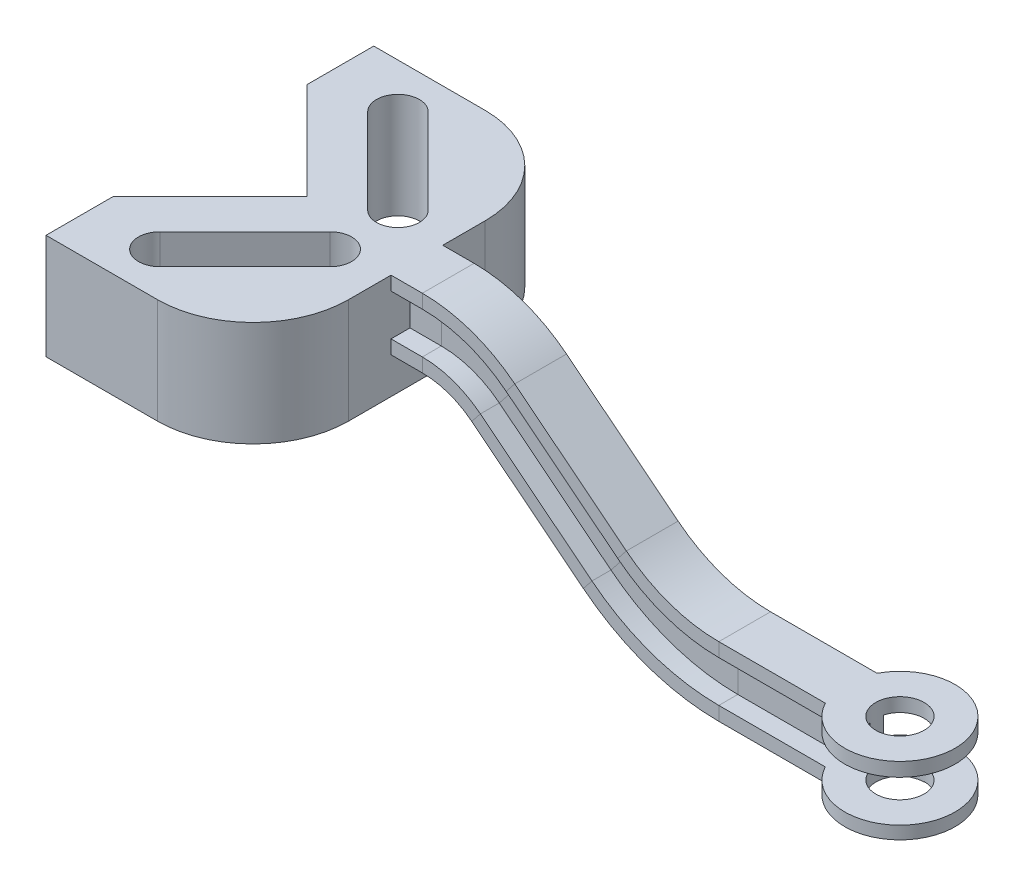
from build123d import *

# Parameters (mm, degrees)
BOSS_EXTRUDE1_DEPTH = 152.5
SKETCH9_R           = 35
CUT_EXTRUDE1_DEPTH  = 152.5


with BuildPart() as part:
    # Sketch1 → Boss-Extrude1 (new body)
    # profile 1 of 2: a face of its own
    with BuildSketch(Plane(origin=(0, 0, 0), x_dir=(1, 0, 0), z_dir=(0, 1, 0))):
        with BuildLine():
            Line((300, 0), (140.492545905, 0))
            Line((140.492545905, 0), (0, -140.492545905))
            Line((0, -140.492545905), (0, -237.5))
            Line((0, -237.5), (161.5, -237.5))
            ThreePointArc((161.5, -237.5), (259.434289194, -196.934289194), (300, -99))
            Line((300, -99), (300, 0))
        make_face()
        with BuildLine():
            Line((245.352869941, -70.987750493), (121.920310217, -194.420310217))
            ThreePointArc((121.920310217, -194.420310217), (78.079689783, -194.420310217), (78.079689783, -150.579689783))
            Line((78.079689783, -150.579689783), (201.512249507, -27.147130059))
            ThreePointArc((201.512249507, -27.147130059), (245.352869941, -27.147130059), (245.352869941, -70.987750493))
        make_face(mode=Mode.SUBTRACT)
    # profile 2 of 2: a face of its own
    with BuildSketch(Plane(origin=(0, 0, 0), x_dir=(1, 0, 0), z_dir=(0, 1, 0))):
        with BuildLine():
            Line((0, 237.5), (0, 140.492545905))
            Line((0, 140.492545905), (140.492545905, 0))
            Line((140.492545905, 0), (300, 0))
            Line((300, 0), (300, 99))
            ThreePointArc((300, 99), (259.434289194, 196.934289194), (161.5, 237.5))
            Line((161.5, 237.5), (0, 237.5))
        make_face()
        with BuildLine():
            ThreePointArc((78.079689783, 150.579689783), (78.079689783, 194.420310217), (121.920310217, 194.420310217))
            Line((121.920310217, 194.420310217), (245.352869941, 70.987750493))
            ThreePointArc((245.352869941, 70.987750493), (245.352869941, 27.147130059), (201.512249507, 27.147130059))
            Line((201.512249507, 27.147130059), (78.079689783, 150.579689783))
        make_face(mode=Mode.SUBTRACT)
    extrude(amount=BOSS_EXTRUDE1_DEPTH)

    # Sweep2: sweep along a path in Sketch2
    with BuildLine(Plane.XY) as sweep2_path:
        Line((300, 152.5), (345.356342374, 152.5))
        ThreePointArc((345.356342374, 152.5), (416.313076896, 140.45354598), (479.318397094, 105.664110009))
        Line((479.318397094, 105.664110009), (641.03794528, -23.164110009))
        ThreePointArc((641.03794528, -23.164110009), (704.043265478, -57.95354598), (775, -70))
        Line((775, -70), (1000, -70))
    # Sketch3 → Sweep2 (sweep)
    with BuildSketch(Plane(origin=(300, 0, 0), x_dir=(0, 0, -1), z_dir=(1, 0, 0))):
        Polygon((-37.5, 152.5), (37.5, 152.5), (37.5, 132.5), (10, 132.5), (10, 72.5), (37.5, 72.5), (37.5, 52.5), (-37.5, 52.5), (-37.5, 72.5), (-10, 72.5), (-10, 132.5), (-37.5, 132.5), align=None)
    sweep(path=sweep2_path.line)

    # Sketch7 → Revolve2 (revolve)
    with BuildSketch(Plane(origin=(0, 0, 0), x_dir=(-1, 0, 0), z_dir=(0, 0, -1))):
        Polygon((-920, -70), (-920, -90), (-990, -90), (-990, -150), (-920.012979842, -150), (-920.012979842, -168.558956517), (-1000, -170), (-1000, -70), align=None)
    revolve(axis=Axis((1000, -43.921847772, 0), (0, -1, 0)))

    # Sketch9 → Cut-Extrude1 (cut)
    with BuildSketch(Plane(origin=(0, -70, 0), x_dir=(1, 0, 0), z_dir=(0, 1, 0))):
        with Locations(Location((1000, 0, 0), (0, 0, 180))):
            Circle(SKETCH9_R)
    extrude(amount=-CUT_EXTRUDE1_DEPTH, mode=Mode.SUBTRACT)


solid = part.part
